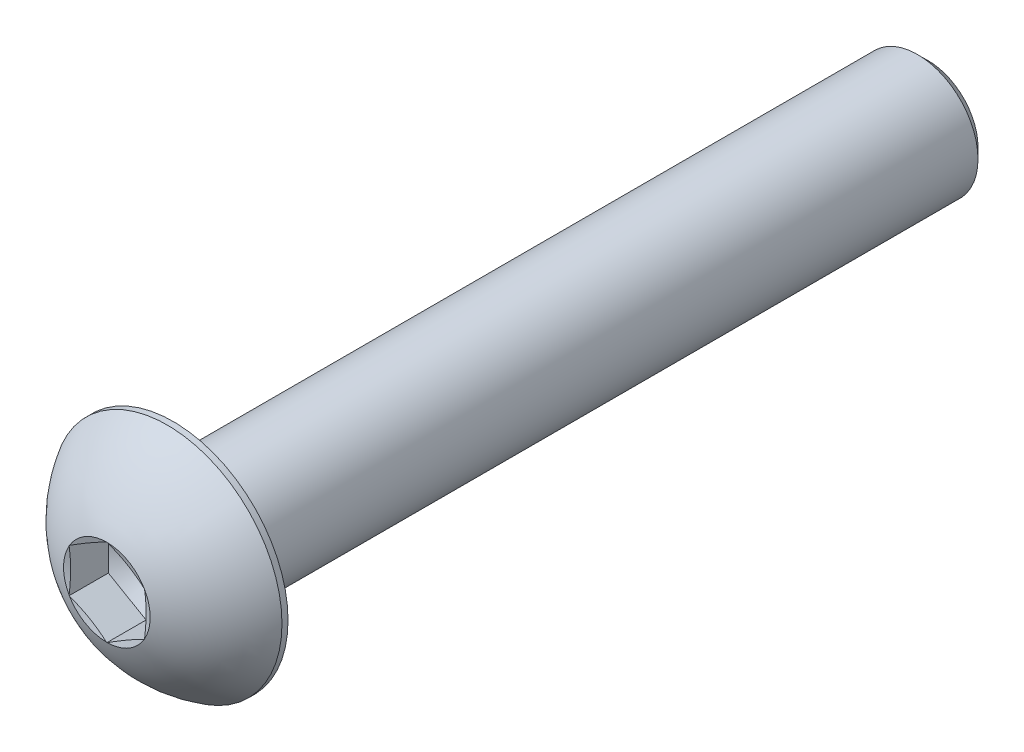
from build123d import *

# Parameters (mm, degrees)
CUT_EXTRUDE2_DEPTH = 1.3


with BuildPart() as part:
    # Sketch1 → Revolve1 (revolve)
    with BuildSketch(Plane(origin=(0, 0, 0), x_dir=(0, 0, -1), z_dir=(1, 0, 0)), mode=Mode.PRIVATE) as revolve1_sk:
        with BuildLine():
            Line((0, 0), (0, 1.435))
            ThreePointArc((0, 1.435), (0.794963972, 2.79089199), (2, 3.8))
            Line((2, 3.8), (2.2, 3.8))
            Line((2.2, 3.8), (2.2, 2.2))
            ThreePointArc((2.2, 2.2), (2.258578644, 2.058578644), (2.4, 2))
            Line((2.4, 2), (26.85, 2))
            Line((26.85, 2), (27.2, 1.65))
            Line((27.2, 1.65), (27.2, 0))
            Line((27.2, 0), (0, 0))
        make_face()
    revolve(revolve1_sk.sketch.rotate(Axis((0, 0, 0), (0, 0, -1)), 90), axis=Axis((0, 0, 0), (0, 0, -1)))

    # Sketch2 → Cut-Extrude2 (cut)
    with BuildSketch(Plane.XY):
        Polygon((0, -1.443375673), (1.25, -0.721687836), (1.25, 0.721687836), (0, 1.443375673), (-1.25, 0.721687836), (-1.25, -0.721687836), align=None)
    extrude(amount=-CUT_EXTRUDE2_DEPTH, mode=Mode.SUBTRACT)

    # Sketch5 → Cut-Revolve3 (revolve, cut)
    with BuildSketch(Plane(origin=(0, 0, 0), x_dir=(0, 0, -1), z_dir=(1, 0, 0)), mode=Mode.PRIVATE) as cut_revolve3_sk:
        Polygon((0.049570601, -1.25), (0, -1.435), (0, -1.25), align=None)
    revolve(cut_revolve3_sk.sketch.rotate(Axis((0, 0, 0), (0, 0, -1)), 119.415596887), axis=Axis((0, 0, 0), (0, 0, -1)), mode=Mode.SUBTRACT)

    # Sketch4 → Cut-Revolve2 (revolve, cut)
    with BuildSketch(Plane(origin=(0, 0, 0), x_dir=(0, 0, -1), z_dir=(1, 0, 0)), mode=Mode.PRIVATE) as cut_revolve2_sk:
        Polygon((1.3, 0), (1.3, -1.443375673), (2.133333333, 0), align=None)
    revolve(cut_revolve2_sk.sketch.rotate(Axis((0, 0, -1.3), (0, 0, -1)), 119.415596887), axis=Axis((0, 0, -1.3), (0, 0, -1)), mode=Mode.SUBTRACT)


solid = part.part
